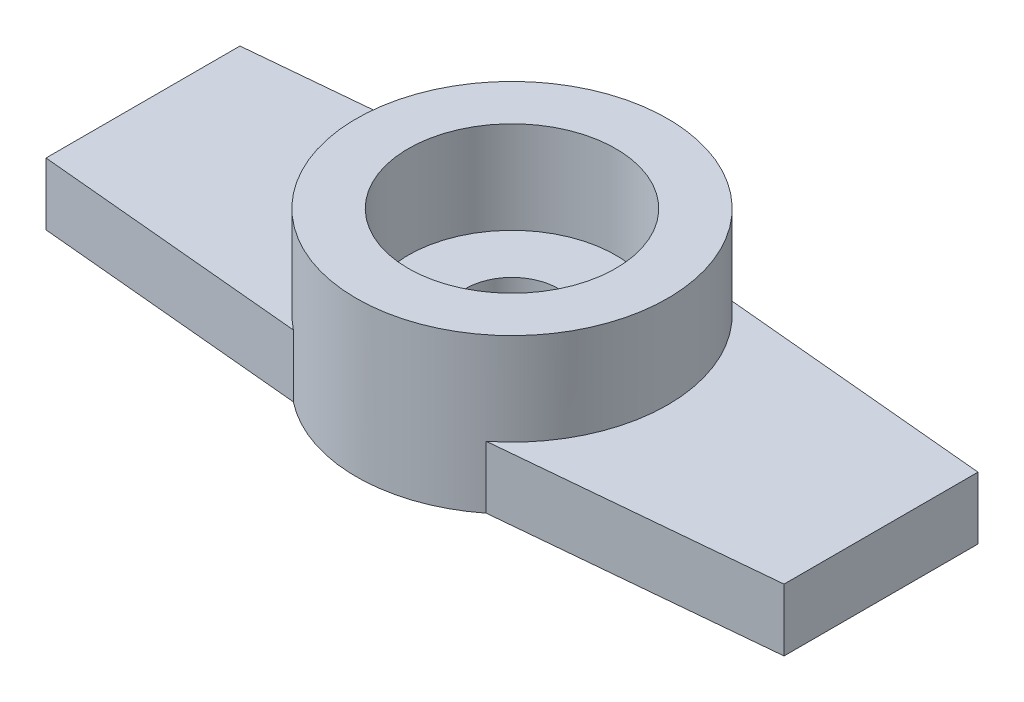
from build123d import *

# Parameters (mm, degrees)
ESTRUSIONE_ESTRUSIONE1_DEPTH = 1.35
SCHIZZO2_R                   = 3.375
ESTRUSIONE_ESTRUSIONE2_DEPTH = 2
SCHIZZO3_R                   = 2.25
TAGLIO_ESTRUSIONE1_DEPTH     = 2
SCHIZZO4_R                   = 1
TAGLIO_ESTRUSIONE2_DEPTH     = 9.910141694


with BuildPart() as part:
    # Schizzo1 → Estrusione-Estrusione1 (new body)
    with BuildSketch(Plane(origin=(0, 0, 0), x_dir=(1, 0, 0), z_dir=(0, 1, 0))):
        with BuildLine():
            Line((8, 2.102337115), (2.090005981, 2.65))
            ThreePointArc((2.090005981, 2.65), (3.036807138, 1.472558117), (3.375, 0))
            ThreePointArc((3.375, 0), (3.036807138, -1.472558117), (2.090005981, -2.65))
            Line((2.090005981, -2.65), (8, -2.102337115))
            Line((8, -2.102337115), (8, 2.102337115))
        make_face()
        with BuildLine():
            ThreePointArc((2.090005981, 2.65), (0, 3.375), (-2.090005981, 2.65))
            Line((-2.090005981, 2.65), (-2.090005981, -2.65))
            ThreePointArc((-2.090005981, -2.65), (0, -3.375), (2.090005981, -2.65))
            Line((2.090005981, -2.65), (2.090005981, 2.65))
        make_face()
        with BuildLine():
            ThreePointArc((-2.090005981, -2.65), (-3.375, 0), (-2.090005981, 2.65))
            Line((-2.090005981, 2.65), (-8, 2.102337115))
            Line((-8, 2.102337115), (-8, -2.102337115))
            Line((-8, -2.102337115), (-2.090005981, -2.65))
        make_face()
        with BuildLine():
            Line((-2.090005981, -2.65), (-2.090005981, 2.65))
            ThreePointArc((-2.090005981, 2.65), (-3.375, 0), (-2.090005981, -2.65))
        make_face()
        with BuildLine():
            ThreePointArc((3.375, 0), (3.036807138, 1.472558117), (2.090005981, 2.65))
            Line((2.090005981, 2.65), (2.090005981, -2.65))
            ThreePointArc((2.090005981, -2.65), (3.036807138, -1.472558117), (3.375, 0))
        make_face()
    extrude(amount=ESTRUSIONE_ESTRUSIONE1_DEPTH)

    # Schizzo2 → Estrusione-Estrusione2 (add)
    with BuildSketch(Plane(origin=(0, 1.35, 0), x_dir=(1, 0, 0), z_dir=(0, 1, 0))):
        with Locations(Location((0, 0, 0), (0, 0, 51.737808872))):
            Circle(SCHIZZO2_R)
    extrude(amount=ESTRUSIONE_ESTRUSIONE2_DEPTH)

    # Schizzo3 → Taglio-Estrusione1 (cut)
    with BuildSketch(Plane(origin=(0, 3.35, 0), x_dir=(1, 0, 0), z_dir=(0, 1, 0))):
        with Locations(Location((0, 0, 0), (0, 0, 270))):
            Circle(SCHIZZO3_R)
    extrude(amount=-TAGLIO_ESTRUSIONE1_DEPTH, mode=Mode.SUBTRACT)

    # Schizzo4 → Taglio-Estrusione2 (cut, through all)
    with BuildSketch(Plane(origin=(0, 1.35, 0), x_dir=(1, 0, 0), z_dir=(0, 1, 0))):
        with Locations(Location((0, 0, 0), (0, 0, 270))):
            Circle(SCHIZZO4_R)
    extrude(amount=-TAGLIO_ESTRUSIONE2_DEPTH, mode=Mode.SUBTRACT)


solid = part.part
